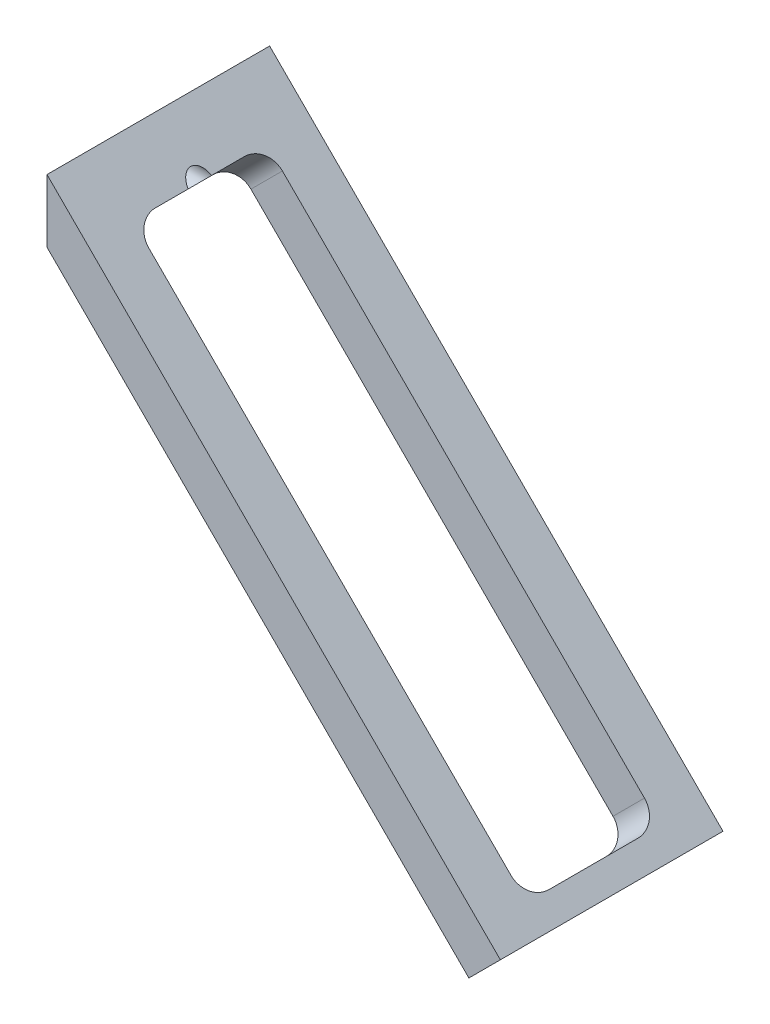
from build123d import *

# Parameters (mm, degrees)
BOSS_EXTRUDE1_DEPTH       = 15.875
SKETCH2_W                 = 19.05
SKETCH2_H                 = 79.375
CUT_EXTRUDE1_DEPTH        = 12.7
FILLET1_R                 = 3.175
F_8_CLEARANCE_HOLE1_D     = 4.4958
F_8_CLEARANCE_HOLE1_DEPTH = 16.51
F_8_CLEARANCE_HOLE1_TIP   = 1.350674586
F_8_32_TAPPED_HOLE1_D     = 3.4544


with BuildPart() as part:
    # Sketch1 → Boss-Extrude1 (new, symmetric)
    with BuildSketch(Plane.XY):
        Polygon((-32.328922036, 32.328922036), (-32.328922036, 23.348665915), (27.838793975, -36.819050096), (32.328922036, -32.328922036), align=None)
    extrude(amount=BOSS_EXTRUDE1_DEPTH, both=True)

    # Sketch2 → Cut-Extrude1 (cut)
    with BuildSketch(Plane(origin=(0, 0, 0), x_dir=(0, 0, -1), z_dir=(0.7071067811865461, 0.707106781186549, 0))):
        with Locations((0, -2.3495)):
            Rectangle(SKETCH2_W, SKETCH2_H)
    extrude(amount=-CUT_EXTRUDE1_DEPTH, mode=Mode.SUBTRACT)

    # Fillet1
    fillet1_edges = [part.edges().sort_by_distance(p)[0] for p in [
        (27.47958373, -31.969711791, 9.525),
        (-28.647017026, 24.156888966, 9.525),
        (-28.647017026, 24.156888966, -9.525),
        (27.47958373, -31.969711791, -9.525),
    ]]
    fillet(fillet1_edges, radius=FILLET1_R)

    # #8 Clearance Hole1
    with Locations(Plane(origin=(29.724647761, -29.724647761, 0), x_dir=(0, 0, 1), z_dir=(-0.7071067811865489, 0.7071067811865462, 0))):
        with Locations((0, -3.175)):
            Hole(F_8_CLEARANCE_HOLE1_D / 2, depth=F_8_CLEARANCE_HOLE1_DEPTH)
            with Locations((0, 0, -(F_8_CLEARANCE_HOLE1_DEPTH + F_8_CLEARANCE_HOLE1_TIP / 2))):  # 118° drill point
                Cone(0, F_8_CLEARANCE_HOLE1_D / 2, F_8_CLEARANCE_HOLE1_TIP, mode=Mode.SUBTRACT)

    # #8-32 Tapped Hole1 (through all)
    with Locations(Plane.ZY.offset(32.328922036)):
        with Locations((0, 25.978922036)):
            Hole(F_8_32_TAPPED_HOLE1_D / 2)


solid = part.part
